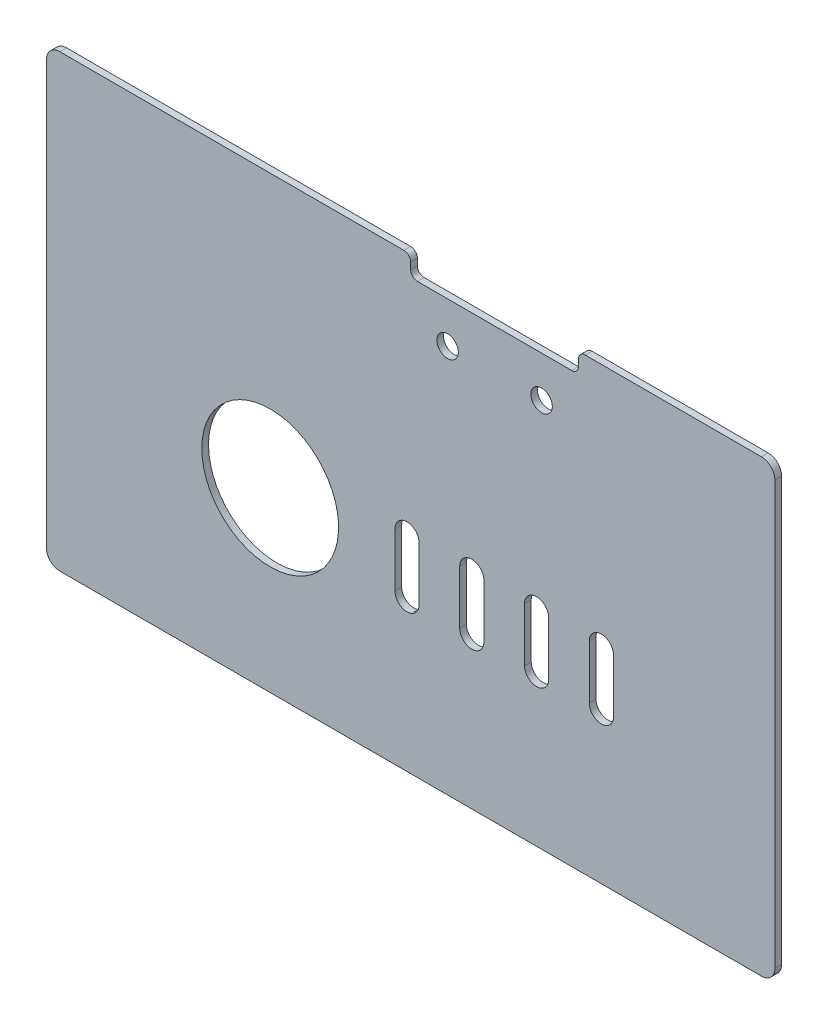
from build123d import *

# Parameters (mm, degrees)
SKETCH_1_W          = 127.5
SKETCH_1_H          = 70
SKETCH_1_R          = 1.6
EXTRUDE_1_DEPTH     = 1
SKETCH_2_W          = 127.5
SKETCH_2_H          = 3
CUT_EXTRUDE_1_DEPTH = 10
SKETCH_3_W          = 22
SKETCH_3_H          = 67
CUT_EXTRUDE_2_DEPTH = 10
SKETCH_4_W          = 3
SKETCH_4_H          = 67
EXTRUDE_3_DEPTH     = 1
CUT_EXTRUDE_3_DEPTH = 5
FILLET_1_R          = 2
SKETCH_6_W          = 25
SKETCH_6_H          = 6
CUT_EXTRUDE_4_DEPTH = 10
FILLET_2_R          = 1


with BuildPart() as part:
    # 草图1 → 凸台-拉伸1 (new body)
    with BuildSketch(Plane.XY):
        Rectangle(SKETCH_1_W, SKETCH_1_H)
        with Locations((-7, 22.9)):
            Circle(SKETCH_1_R, mode=Mode.SUBTRACT)
        with Locations((7, 22.9)):
            Circle(SKETCH_1_R, mode=Mode.SUBTRACT)
    extrude(amount=EXTRUDE_1_DEPTH)

    # 草图2 → 切除-拉伸1 (cut)
    with BuildSketch(Plane.XY.offset(1)):
        with Locations((0, 33.5)):
            Rectangle(SKETCH_2_W, SKETCH_2_H)
    extrude(amount=-CUT_EXTRUDE_1_DEPTH, mode=Mode.SUBTRACT)

    # 草图3 → 切除-拉伸2 (cut)
    with BuildSketch(Plane.XY.offset(1)):
        with Locations((52.75, -1.5)):
            Rectangle(SKETCH_3_W, SKETCH_3_H)
    extrude(amount=-CUT_EXTRUDE_2_DEPTH, mode=Mode.SUBTRACT)

    # 草图4 → 凸台-拉伸3 (add)
    with BuildSketch(Plane.XY.offset(1)):
        with Locations((-65.25, -1.5)):
            Rectangle(SKETCH_4_W, SKETCH_4_H)
    extrude(amount=-EXTRUDE_3_DEPTH)

    # 草图5 → 切除-拉伸3 (cut, symmetric)
    with BuildSketch(Plane.XY.offset(1)):
        with BuildLine():
            add(Edge.make_bspline(
                [(-23.239204387, -8.309235678), (-23.820747006, 12.052355547), (-44.182338231, 11.470812929), (-43.600795613, -8.890778296), (-43.019252994, -29.252369521), (-22.657661769, -28.670826903), (-23.239204387, -8.309235678)],
                knots=[0, 0, 0, 0, 0.5, 0.5, 0.5, 1, 1, 1, 1], degree=3, weights=[1, 0.333333333, 0.333333333, 1, 0.333333333, 0.333333333, 1]))
        make_face()
        with BuildLine():
            Line((-11.240001226, -12.590835312), (-11.239812554, -4.590030484))
            add(Edge.make_bspline(
                [(-11.239812554, -4.590030484), (-11.23965851, -4.131191724), (-11.628394939, -3.175174974), (-13.03773959, -2.598676522), (-14.448144996, -3.173577827), (-14.838335624, -4.130052792), (-14.838682322, -4.589251905)],
                knots=[0.000124436, 0.000124436, 0.000124436, 0.000124436, 0.250093327, 0.500062218, 0.750031109, 1, 1, 1, 1], degree=3))
            Line((-14.838682322, -4.589251905), (-14.839059277, -12.589975952))
            add(Edge.make_bspline(
                [(-14.839059277, -12.589975952), (-14.83906612, -13.048792969), (-14.45006572, -14.004600337), (-13.04067713, -14.58087189), (-11.630099776, -14.005244049), (-11.240750672, -13.049730112), (-11.240001226, -12.590835312)],
                knots=[-6.415e-06, -6.415e-06, -6.415e-06, -6.415e-06, 0.250075228, 0.50015687, 0.750238513, 1.000320156, 1.000320156, 1.000320156, 1.000320156], degree=3))
        make_face()
        with BuildLine():
            Line((-1.590572104, -12.590006951), (-1.590572104, -4.5900069))
            ThreePointArc((-1.590572104, -4.5900069), (-3.39056929, -2.790009714), (-5.190566476, -4.5900069))
            Line((-5.190566476, -4.5900069), (-5.190566476, -12.590006951))
            ThreePointArc((-5.190566476, -12.590006951), (-3.39056929, -14.390004137), (-1.590572104, -12.590006951))
        make_face()
        with BuildLine():
            Line((8.059432501, -12.590006951), (8.059432501, -4.5900069))
            ThreePointArc((8.059432501, -4.5900069), (6.259435314, -2.790009714), (4.459438128, -4.5900069))
            Line((4.459438128, -4.5900069), (4.459438128, -12.590006951))
            ThreePointArc((4.459438128, -12.590006951), (6.259435314, -14.390004137), (8.059432501, -12.590006951))
        make_face()
        with BuildLine():
            Line((17.709430966, -12.590006951), (17.709430966, -4.5900069))
            ThreePointArc((17.709430966, -4.5900069), (15.909433779, -2.790009714), (14.109436593, -4.5900069))
            Line((14.109436593, -4.5900069), (14.109436593, -12.590006951))
            ThreePointArc((14.109436593, -12.590006951), (15.909433779, -14.390004137), (17.709430966, -12.590006951))
        make_face()
    extrude(amount=CUT_EXTRUDE_3_DEPTH, both=True, mode=Mode.SUBTRACT)

    # 圆角1
    fillet_1_edges = [part.edges().sort_by_distance(p)[0] for p in [
        (41.75, 32, 0.5),
        (41.75, -35, 0.5),
        (-66.75, -35, 0.5),
        (-66.75, 32, 0.5),
    ]]
    fillet(fillet_1_edges, radius=FILLET_1_R)

    # 草图6 → 切除-拉伸4 (cut)
    with BuildSketch(Plane.XY.offset(1)):
        with Locations((0, 32)):
            Rectangle(SKETCH_6_W, SKETCH_6_H)
    extrude(amount=-CUT_EXTRUDE_4_DEPTH, mode=Mode.SUBTRACT)

    # 圆角2
    fillet_2_edges = [part.edges().sort_by_distance(p)[0] for p in [
        (-12.5, 32, 0.5),
        (12.5, 32, 0.5),
        (12.5, 29, 0.5),
        (-12.5, 29, 0.5),
    ]]
    fillet(fillet_2_edges, radius=FILLET_2_R)


solid = part.part
